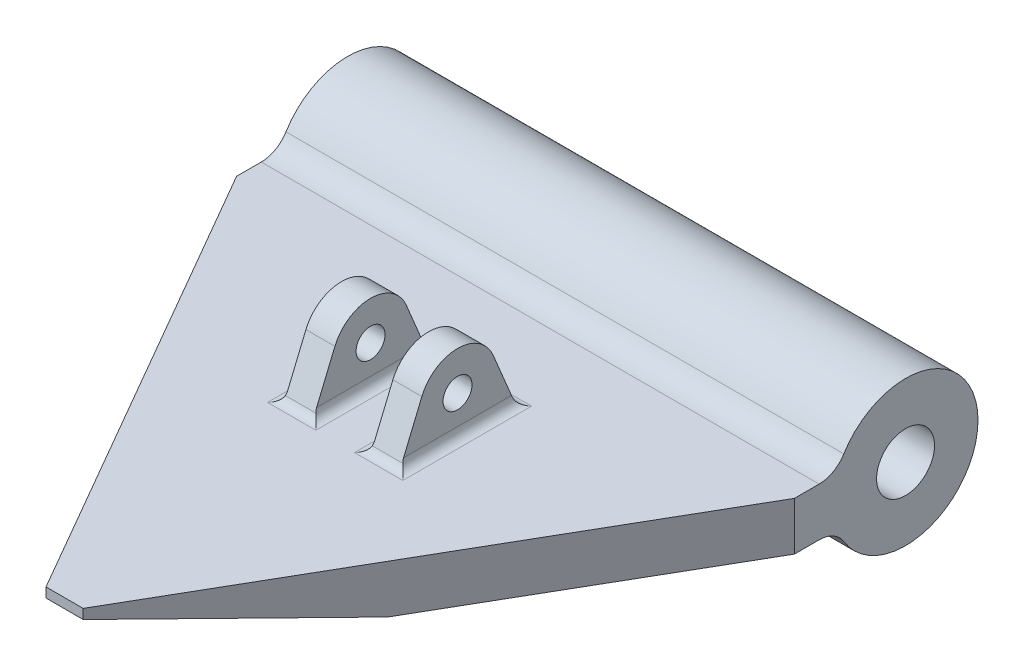
from build123d import *

# Parameters (mm, degrees)
BOSS_EXTRUDE1_DEPTH = 5
SKETCH2_R           = 7.5
SKETCH2_R_2         = 3
BOSS_EXTRUDE2_DEPTH = 57.735026919
CUT_EXTRUDE1_DEPTH  = 57.735026919
CUT_EXTRUDE2_DEPTH  = 5
FILLET1_R           = 3
CUT_EXTRUDE3_DEPTH  = 0.5
CHAMFER1_SIZE       = 4
CHAMFER1_SIZE2      = 20
BOSS_EXTRUDE3_START = 3
SKETCH5_R           = 1.5
BOSS_EXTRUDE3_DEPTH = 3
FILLET2_R           = 1


with BuildPart() as part:
    # Sketch1 → Boss-Extrude1 (new body)
    with BuildSketch(Plane(origin=(0, 0, 0), x_dir=(1, 0, 0), z_dir=(0, 1, 0))):
        Polygon((-28.867513459, 50), (-28.867513459, 70), (28.867513459, 70), (28.867513459, 50), (0, 0), align=None)
    extrude(amount=BOSS_EXTRUDE1_DEPTH)

    # Sketch2 → Boss-Extrude2 (add)
    with BuildSketch(Plane(origin=(28.867513459, 0, 0), x_dir=(0, 0, -1), z_dir=(1, 0, 0))):
        with Locations((62.5, 2.5)):
            Circle(SKETCH2_R)
        with Locations((62.5, 2.5)):
            Circle(SKETCH2_R_2, mode=Mode.SUBTRACT)
    extrude(amount=-BOSS_EXTRUDE2_DEPTH)

    # Sketch2<2> → Cut-Extrude1 (cut)
    with BuildSketch(Plane(origin=(28.867513459, 0, 0), x_dir=(0, 0, -1), z_dir=(1, 0, 0))):
        with BuildLine():
            ThreePointArc((65.5, 2.5), (65.143382037, 3.918637165), (64.158312395, 5))
            Line((64.158312395, 5), (60.841687605, 5))
            ThreePointArc((60.841687605, 5), (59.5, 2.5), (60.841687605, 0))
            Line((60.841687605, 0), (64.158312395, 0))
            ThreePointArc((64.158312395, 0), (65.143382037, 1.081362835), (65.5, 2.5))
        make_face()
        with BuildLine():
            Line((60.841687605, 5), (64.158312395, 5))
            ThreePointArc((64.158312395, 5), (62.5, 5.5), (60.841687605, 5))
        make_face()
        with BuildLine():
            ThreePointArc((60.841687605, 0), (62.5, -0.5), (64.158312395, 0))
            Line((64.158312395, 0), (60.841687605, 0))
        make_face()
        with BuildLine():
            ThreePointArc((69.571067812, 5), (69.891989197, 3.76826484), (70, 2.5))
            Line((70, 2.5), (70, 5))
            Line((70, 5), (69.571067812, 5))
        make_face()
        with BuildLine():
            Line((70, 0), (70, 2.5))
            ThreePointArc((70, 2.5), (69.891989197, 1.23173516), (69.571067812, 0))
            Line((69.571067812, 0), (70, 0))
        make_face()
    extrude(amount=-CUT_EXTRUDE1_DEPTH, mode=Mode.SUBTRACT)

    # Sketch3 → Cut-Extrude2 (cut)
    with BuildSketch(Plane(origin=(0, 5, 0), x_dir=(1, 0, 0), z_dir=(0, 1, 0))):
        Polygon((-2.5, 4.330127019), (2.5, 4.330127019), (0, 0), align=None)
    extrude(amount=-CUT_EXTRUDE2_DEPTH, mode=Mode.SUBTRACT)

    # Fillet1
    fillet1_edges = [part.edges().sort_by_distance(p)[0] for p in [
        (0, 0, -55.428932188),
        (0, 5, -55.428932188),
    ]]
    fillet(fillet1_edges, radius=FILLET1_R)

    # Sketch4 → Cut-Extrude3 (cut)
    with BuildSketch(Plane(origin=(0, 0, 0), x_dir=(0.5000000000000001, 0, -0.8660254037844386), z_dir=(0.8660254037844386, 0, 0.5000000000000001))):
        with BuildLine():
            Line((57.735026919, 0), (60.814377774, 0))
            add(Edge.make_bspline(
                [(63.027511115, -1.428571429), (62.266746529, 0), (60.814377774, 0)],
                knots=[2.122113296, 2.122113296, 2.122113296, 3.141592654, 3.141592654, 3.141592654], degree=2, weights=[1, 0.872871561, 1]))
            add(Edge.make_bspline(
                [(63.027511115, -1.428571429), (75.055534995, -24.014916241), (75.055534995, 2.5), (75.055534995, 29.014916241), (63.027511115, 6.428571429)],
                knots=[5.26370595, 5.26370595, 5.26370595, 7.853981634, 7.853981634, 10.444257318, 10.444257318, 10.444257318], degree=2, weights=[1, 0.27218062, 1, 0.27218062, 1]))
            add(Edge.make_bspline(
                [(60.814377774, 5), (62.266746529, 5), (63.027511115, 6.428571429)],
                knots=[3.141592654, 3.141592654, 3.141592654, 4.161072011, 4.161072011, 4.161072011], degree=2, weights=[1, 0.872871561, 1]))
            Line((60.814377774, 5), (57.735026919, 5))
            Line((57.735026919, 5), (5, 5))
            Line((5, 5), (2.5, 5))
            Line((2.5, 5), (2.5, 0))
            Line((2.5, 0), (5, 0))
            Line((5, 0), (57.735026919, 0))
        make_face()
    cut_extrude3 = extrude(amount=-CUT_EXTRUDE3_DEPTH, mode=Mode.SUBTRACT)

    # Mirror1: Cut-Extrude3 across plane
    add(cut_extrude3.mirror(Plane(origin=(0, 0, 0), x_dir=(0, 0, 1), z_dir=(1, 0, 0))), mode=Mode.SUBTRACT)

    # Chamfer1
    chamfer1_edges = [part.edges().sort_by_distance(p)[0] for p in [
        (0, 0, -4.330127019),
    ]]
    chamfer1_side = [part.faces().sort_by_distance(p)[0] for p in [
        (0, 2.5, -4.330127019),
    ]]
    chamfer(chamfer1_edges, length=CHAMFER1_SIZE, length2=CHAMFER1_SIZE2, reference=chamfer1_side[0])

    # Sketch5 → Boss-Extrude3 (add)
    with BuildSketch(Plane(origin=(0, 0, 0), x_dir=(0, 0, -1), z_dir=(1, 0, 0)).offset(BOSS_EXTRUDE3_START)):
        with BuildLine():
            Line((35.307692308, 10.538461538), (33, 5))
            Line((33, 5), (45, 5))
            Line((45, 5), (42.692307692, 10.538461538))
            ThreePointArc((42.692307692, 10.538461538), (39, 13), (35.307692308, 10.538461538))
        make_face()
        with Locations((39, 9)):
            Circle(SKETCH5_R, mode=Mode.SUBTRACT)
    boss_extrude3 = extrude(amount=BOSS_EXTRUDE3_DEPTH)

    # Mirror2: Boss-Extrude3 across plane
    add(boss_extrude3.mirror(Plane(origin=(0, 0, 0), x_dir=(0, 0, 1), z_dir=(1, 0, 0))))

    # Fillet2
    fillet2_edges = [part.edges().sort_by_distance(p)[0] for p in [
        (6, 5, -39),
        (3, 5, -39),
        (4.5, 5, -33),
        (4.5, 5, -45),
        (-6, 5, -39),
        (-4.5, 5, -45),
        (-4.5, 5, -33),
        (-3, 5, -39),
    ]]
    fillet(fillet2_edges, radius=FILLET2_R)


solid = part.part
